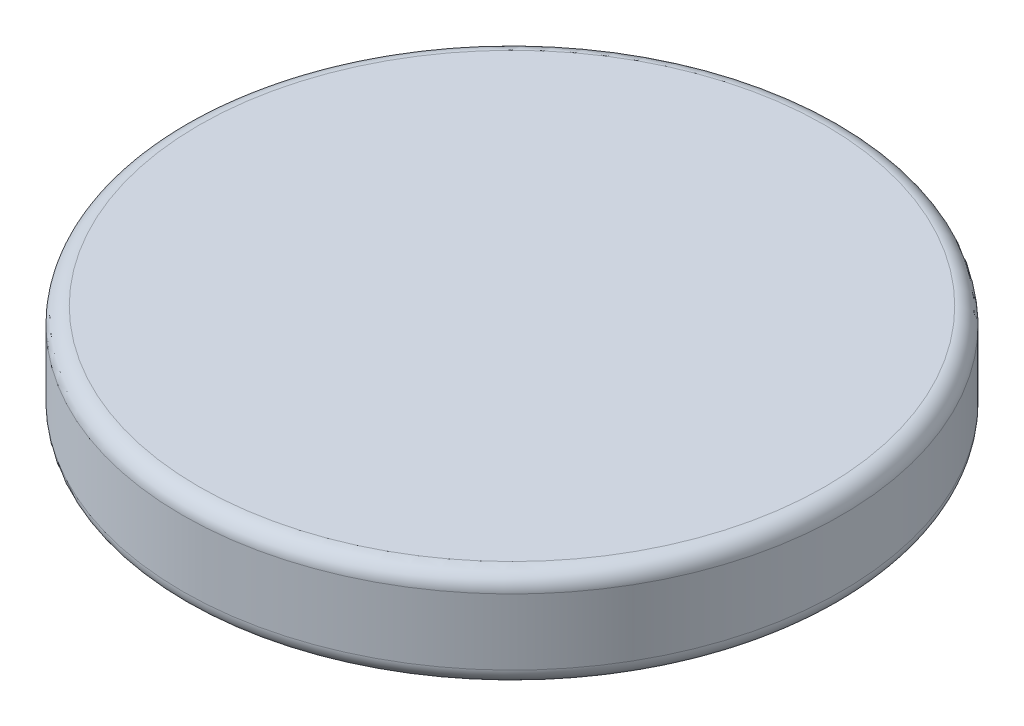
from build123d import *

# Parameters (mm, degrees)
SKETCH1_R           = 10
BOSS_EXTRUDE1_DEPTH = 1.5
FILLET1_R           = 0.5


with BuildPart() as part:
    # Sketch1 → Boss-Extrude1 (new, symmetric)
    with BuildSketch(Plane(origin=(0, 0, 0), x_dir=(1, 0, 0), z_dir=(0, 1, 0))):
        with Locations(Location((0, 0, 0), (0, 0, 270))):
            Circle(SKETCH1_R)
    extrude(amount=BOSS_EXTRUDE1_DEPTH, both=True)

    # Fillet1
    fillet1_edges = [part.edges().sort_by_distance(p)[0] for p in [
        (0, -1.5, -10),
        (0, 1.5, -10),
    ]]
    fillet(fillet1_edges, radius=FILLET1_R)


solid = part.part
